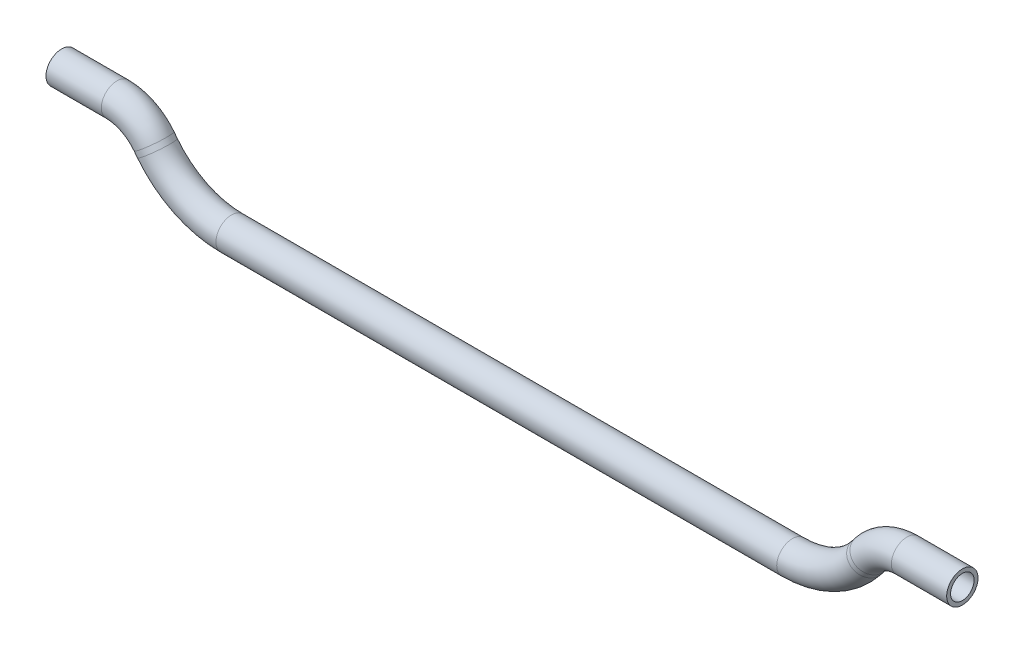
from build123d import *

# Parameters (mm, degrees)
SKETCH3_R   = 20
SKETCH3_R_2 = 15


with BuildPart() as part:
    # Sweep1: sweep along a path in Sketch2
    with BuildLine(Plane.XY) as sweep1_path:
        Line((0, 0), (70.636050153, 0))
        ThreePointArc((70.636050153, 0), (97.010850822, -6.107793795), (118.015923362, -23.187670345))
        Line((118.015923362, -23.187670345), (122.240253581, -28.624659311))
        ThreePointArc((122.240253581, -28.624659311), (164.250398662, -62.78441241), (217, -75))
        Line((217, -75), (933, -75))
        ThreePointArc((933, -75), (985.749601338, -62.78441241), (1027.759746419, -28.624659311))
        Line((1027.759746419, -28.624659311), (1031.984076638, -23.187670345))
        ThreePointArc((1031.984076638, -23.187670345), (1052.989149178, -6.107793795), (1079.363949847, 0))
        Line((1079.363949847, 0), (1150, 0))
    # Sketch3 → Sweep1 (sweep)
    with BuildSketch(Plane(origin=(0, 0, 0), x_dir=(0, 0, -1), z_dir=(1, 0, 0))):
        Circle(SKETCH3_R)
        Circle(SKETCH3_R_2, mode=Mode.SUBTRACT)
    sweep(path=sweep1_path.line)


solid = part.part
